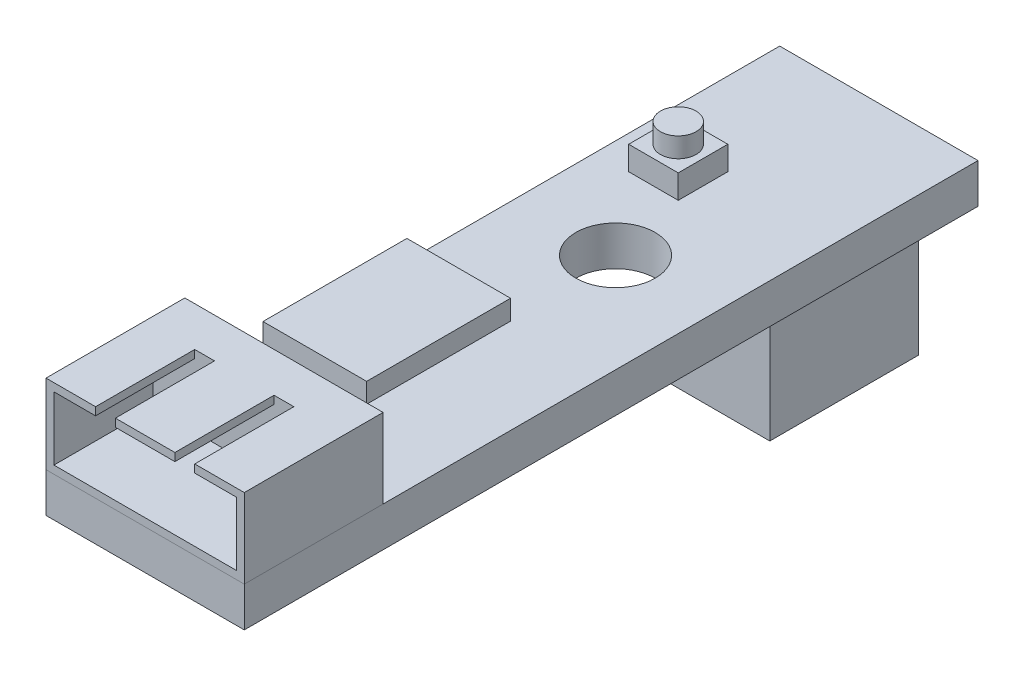
from build123d import *

# Parameters (mm, degrees)
SKETCH_1_W          = 10
SKETCH_1_H          = 37
EXTRUDE_1_DEPTH     = 2
SKETCH_2_W          = 10
SKETCH_2_H          = 7
EXTRUDE_2_DEPTH     = 4
CUT_EXTRUDE_1_DEPTH = 5
SKETCH_4_R          = 2
CUT_EXTRUDE_2_DEPTH = 5
EXTRUDE_3_DEPTH     = 7
SKETCH_6_W          = 5.227328637
SKETCH_6_H          = 7.258677384
EXTRUDE_4_DEPTH     = 1
SKETCH_7_W          = 2.5
SKETCH_7_H          = 2.5
EXTRUDE_5_DEPTH     = 1.2
SKETCH_8_R          = 0.9
EXTRUDE_6_DEPTH     = 1
SKETCH_9_R          = 1.5
CUT_EXTRUDE_3_DEPTH = 1


with BuildPart() as part:
    # 草图1 → 凸台-拉伸1 (new body)
    with BuildSketch(Plane(origin=(0, 0, 0), x_dir=(1, 0, 0), z_dir=(0, 1, 0))):
        Rectangle(SKETCH_1_W, SKETCH_1_H)
    extrude(amount=EXTRUDE_1_DEPTH)

    # 草图4 → 切除-拉伸2 (cut)
    with BuildSketch(Plane.XZ):
        with Locations((0, -5.22098653)):
            Circle(SKETCH_4_R)
    extrude(amount=-CUT_EXTRUDE_2_DEPTH, mode=Mode.SUBTRACT)

    # 草图5 → 凸台-拉伸3 (add)
    with BuildSketch(Plane.XZ):
        Polygon((-2, -10), (3, -10), (3, -17.5), (-3, -17.5), (-3, -11), align=None)
    extrude(amount=EXTRUDE_3_DEPTH)

    # 草图6 → 凸台-拉伸4 (add)
    with BuildSketch(Plane(origin=(0, 2, 0), x_dir=(1, 0, 0), z_dir=(0, 1, 0))):
        with Locations((-2.386335681, -3.929338472)):
            Rectangle(SKETCH_6_W, SKETCH_6_H)
    extrude(amount=EXTRUDE_4_DEPTH)

    # 草图9 → 切除-拉伸3 (cut)
    with BuildSketch(Plane.XZ.offset(7)):
        with Locations((0, -12)):
            Circle(SKETCH_9_R)
        with Locations((0, -15.6)):
            Circle(SKETCH_9_R)
    extrude(amount=-CUT_EXTRUDE_3_DEPTH, mode=Mode.SUBTRACT)

    # 草图10 → 旋转1 (revolve)
    with BuildSketch(Plane(origin=(0, 0, 0), x_dir=(0, -1, 0), z_dir=(1, 0, 0))):
        with BuildLine():
            Line((6, 12), (6.691796367, 12))
            add(Edge.make_bspline(
                [(6, 10.5), (6.763042872, 11.099552197), (6.691796367, 12)],
                knots=[0, 0, 0, 1, 1, 1], degree=2))
            Line((6, 10.5), (6, 12))
        make_face()
    revolve(axis=Axis((0, -6, -12), (0, -1, 0)))

    # 草图11 → 旋转2 (revolve)
    with BuildSketch(Plane(origin=(0, 0, 0), x_dir=(0, -1, 0), z_dir=(1, 0, 0))):
        with BuildLine():
            Line((6, 14.1), (6, 15.6))
            Line((6, 15.6), (6.699650248, 15.6))
            add(Edge.make_bspline(
                [(6, 14.1), (6.724602688, 14.677179589), (6.699650248, 15.6)],
                knots=[0, 0, 0, 1, 1, 1], degree=2))
        make_face()
    revolve(axis=Axis((0, -6, -15.6), (0, -1, 0)))


with BuildPart() as body_2:
    # 草图2 → 凸台-拉伸2 (new body)
    with BuildSketch(Plane(origin=(0, 2, 0), x_dir=(1, 0, 0), z_dir=(0, 1, 0))):
        with Locations((0, -15)):
            Rectangle(SKETCH_2_W, SKETCH_2_H)
    extrude(amount=EXTRUDE_2_DEPTH)

    # 草图3 → 切除-拉伸1 (cut)
    with BuildSketch(Plane.XY.offset(18.5)):
        Polygon((1.5, 6), (1.5, 5.6), (-1.5, 5.6), (-1.5, 6), (-2.5, 6), (-2.5, 5.6), (-4.6, 5.6), (-4.6, 2.4), (4.6, 2.4), (4.6, 5.6), (2.5, 5.6), (2.5, 6), align=None)
    extrude(amount=-CUT_EXTRUDE_1_DEPTH, mode=Mode.SUBTRACT)


with BuildPart() as body_3:
    # 草图7 → 凸台-拉伸5 (new body)
    with BuildSketch(Plane(origin=(0, 2, 0), x_dir=(1, 0, 0), z_dir=(0, 1, 0))):
        with Locations((-2.070135445, 10.45360344)):
            Rectangle(SKETCH_7_W, SKETCH_7_H)
    extrude(amount=EXTRUDE_5_DEPTH)


with BuildPart() as body_4:
    # 草图8 → 凸台-拉伸6 (new body)
    with BuildSketch(Plane(origin=(0, 3.2, 0), x_dir=(1, 0, 0), z_dir=(0, 1, 0))):
        with Locations((-2.070135445, 10.45360344)):
            Circle(SKETCH_8_R)
    extrude(amount=EXTRUDE_6_DEPTH)


solid = Compound([part.part, body_2.part, body_3.part, body_4.part])
